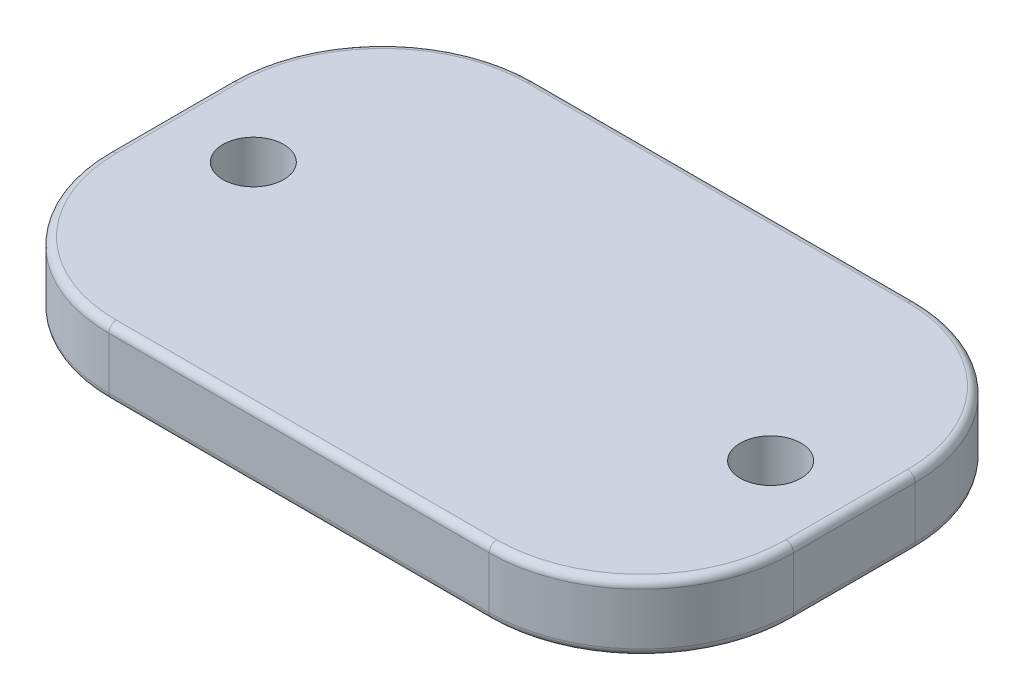
from build123d import *

# Parameters (mm, degrees)
SKETCH1_W           = 45
SKETCH1_H           = 28
BOSS_EXTRUDE1_DEPTH = 4.4
SKETCH2_R           = 2
CUT_EXTRUDE1_DEPTH  = 4.4
FILLET1_R           = 10
SKETCH5_W           = 13.36263447
SKETCH5_H           = 4.8
CUT_EXTRUDE2_DEPTH  = 12.2
FILLET2_R           = 0.5


with BuildPart() as part:
    # Sketch1 → Boss-Extrude1 (new body)
    with BuildSketch(Plane(origin=(0, 0, 0), x_dir=(1, 0, 0), z_dir=(0, 1, 0))):
        Rectangle(SKETCH1_W, SKETCH1_H)
    extrude(amount=BOSS_EXTRUDE1_DEPTH)

    # Sketch2 → Cut-Extrude1 (cut)
    with BuildSketch(Plane(origin=(0, 4.4, 0), x_dir=(1, 0, 0), z_dir=(0, 1, 0))):
        with Locations(Location((-17, 0, 0), (0, 0, 270))):
            Circle(SKETCH2_R)
        with Locations(Location((17, 0, 0), (0, 0, 270))):
            Circle(SKETCH2_R)
    extrude(amount=-CUT_EXTRUDE1_DEPTH, mode=Mode.SUBTRACT)

    # Fillet1
    fillet1_edges = [part.edges().sort_by_distance(p)[0] for p in [
        (22.5, 2.2, 14),
        (-22.5, 2.2, 14),
        (-22.5, 2.2, -14),
        (22.5, 2.2, -14),
    ]]
    fillet(fillet1_edges, radius=FILLET1_R)

    # Sketch4 → Revolve1 (revolve)
    with BuildSketch(Plane.XY, mode=Mode.PRIVATE) as revolve1_sk:
        with BuildLine():
            Line((0, 2), (0, -8.5))
            ThreePointArc((0, -8.5), (7.424621202, -5.424621202), (10.5, 2))
            Line((10.5, 2), (0, 2))
        make_face()
    revolve(revolve1_sk.sketch.rotate(Axis((0, 2, 0), (0, -1, 0)), 180), axis=Axis((0, 2, 0), (0, -1, 0)))

    # Sketch5 → Cut-Extrude2 (cut, symmetric)
    with BuildSketch(Plane.XY):
        with Locations((0, -8.5)):
            Rectangle(SKETCH5_W, SKETCH5_H)
    extrude(amount=CUT_EXTRUDE2_DEPTH, both=True, mode=Mode.SUBTRACT)

    # Fillet2
    fillet2_edges = [part.edges().sort_by_distance(p)[0] for p in [
        (22.5, 0, 0),
        (22.5, 4.4, 0),
        (0, 0, 14),
        (-22.5, 0, 0),
        (0, 0, -14),
        (-19.571067812, 0, 11.071067812),
        (-19.571067812, 0, -11.071067812),
        (19.571067812, 0, -11.071067812),
        (19.571067812, 0, 11.071067812),
        (0, 4.4, 14),
        (0, 4.4, -14),
        (-22.5, 4.4, 0),
        (-19.571067812, 4.4, 11.071067812),
        (-19.571067812, 4.4, -11.071067812),
        (19.571067812, 4.4, -11.071067812),
        (19.571067812, 4.4, 11.071067812),
    ]]
    fillet(fillet2_edges, radius=FILLET2_R)


with BuildPart() as body_2:
    # Sketch6 → Revolve2 (revolve)
    with BuildSketch(Plane(origin=(0, -3.1, 0), x_dir=(-1, 0, 0), z_dir=(0, -1, 0))):
        with BuildLine():
            Line((0, -6), (0, 6))
            ThreePointArc((0, 6), (6, 0), (0, -6))
        make_face()
    revolve(axis=Axis((0, -3.1, 6), (0, 0, -1)))


solid = Compound([part.part, body_2.part])
